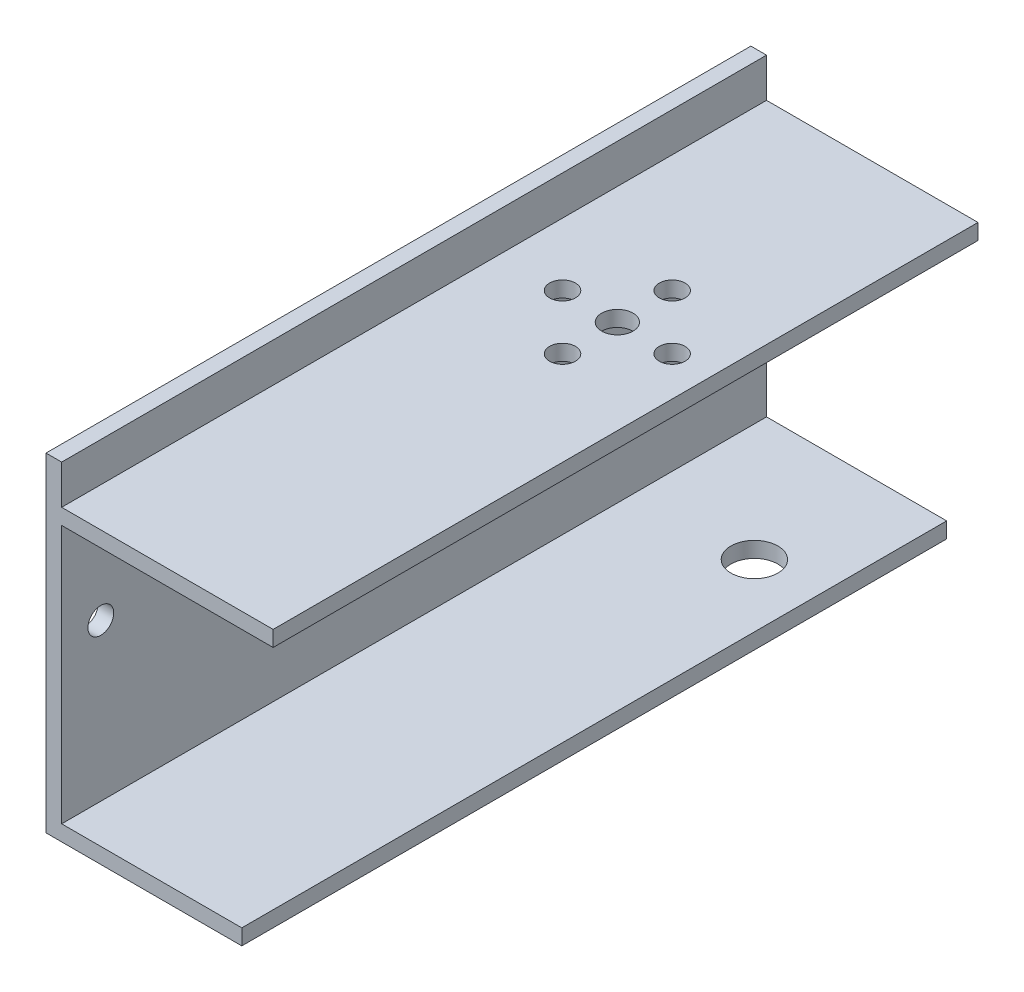
from build123d import *

# Parameters (mm, degrees)
SKETCH_1_W          = 25
SKETCH_1_H          = 90
EXTRUDE_1_DEPTH     = 2
SKETCH_3_W          = 2
SKETCH_3_H          = 90
EXTRUDE_2_DEPTH     = 40
SKETCH_6_R          = 1.65
CUT_EXTRUDE_3_DEPTH = 10
SKETCH_7_R          = 3
CUT_EXTRUDE_4_DEPTH = 10
SKETCH_8_R          = 1.65
CUT_EXTRUDE_5_DEPTH = 10
EXTRUDE_3_DEPTH     = 27
SKETCH_10_R         = 1.65
SKETCH_10_R_2       = 2
CUT_EXTRUDE_7_DEPTH = 6


with BuildPart() as part:
    # 草图1 → 凸台-拉伸1 (new body)
    with BuildSketch(Plane(origin=(0, 0, 0), x_dir=(1, 0, 0), z_dir=(0, 1, 0))):
        Rectangle(SKETCH_1_W, SKETCH_1_H)
    extrude(amount=EXTRUDE_1_DEPTH)

    # 草图3 → 凸台-拉伸2 (add)
    with BuildSketch(Plane(origin=(0, 2, 0), x_dir=(1, 0, 0), z_dir=(0, 1, 0))):
        with Locations((-11.5, 0)):
            Rectangle(SKETCH_3_W, SKETCH_3_H)
    extrude(amount=EXTRUDE_2_DEPTH)

    # 草图6 → 切除-拉伸3 (cut)
    with BuildSketch(Plane.ZY.offset(12.5)):
        with Locations((8, 21)):
            Circle(SKETCH_6_R)
        with Locations((21.524795588, 17.383384964)):
            Circle(SKETCH_6_R)
        with Locations((15, 14)):
            Circle(SKETCH_6_R)
        with Locations((15, 28)):
            Circle(SKETCH_6_R)
    extrude(amount=-CUT_EXTRUDE_3_DEPTH, mode=Mode.SUBTRACT)

    # 草图7 → 切除-拉伸4 (cut)
    with BuildSketch(Plane(origin=(0, 0, 0), x_dir=(-1, 0, 0), z_dir=(0, -1, 0))):
        with Locations(Location((-4.5, 28.45, 0), (0, 0, 90))):
            Circle(SKETCH_7_R)
    extrude(amount=-CUT_EXTRUDE_4_DEPTH, mode=Mode.SUBTRACT)

    # 草图8 → 切除-拉伸5 (cut)
    with BuildSketch(Plane(origin=(-10.5, 0, 0), x_dir=(0, 0, -1), z_dir=(1, 0, 0))):
        with Locations((-40, 22)):
            Circle(SKETCH_8_R)
        with Locations((40, 22)):
            Circle(SKETCH_8_R)
    extrude(amount=-CUT_EXTRUDE_5_DEPTH, mode=Mode.SUBTRACT)

    # 草图9 → 凸台-拉伸3 (add)
    with BuildSketch(Plane(origin=(-10.5, 0, 0), x_dir=(0, 0, -1), z_dir=(1, 0, 0))):
        Polygon((-45, 35), (0, 35), (45, 35), (45, 37), (-45, 37), align=None)
    extrude(amount=EXTRUDE_3_DEPTH)

    # 草图10 → 切除-拉伸7 (cut)
    with BuildSketch(Plane.XZ.offset(-35)):
        with Locations(Location((4.5, -17.95, 0), (0, 0, 270))):
            Circle(SKETCH_10_R)
        with Locations(Location((11.5, -10.95, 0), (0, 0, 270))):
            Circle(SKETCH_10_R)
        with Locations(Location((4.5, -10.95, 0), (0, 0, 270))):
            Circle(SKETCH_10_R_2)
        with Locations(Location((-2.5, -10.95, 0), (0, 0, 270))):
            Circle(SKETCH_10_R)
        with Locations(Location((4.5, -3.95, 0), (0, 0, 270))):
            Circle(SKETCH_10_R)
    extrude(amount=-CUT_EXTRUDE_7_DEPTH, mode=Mode.SUBTRACT)


solid = part.part
